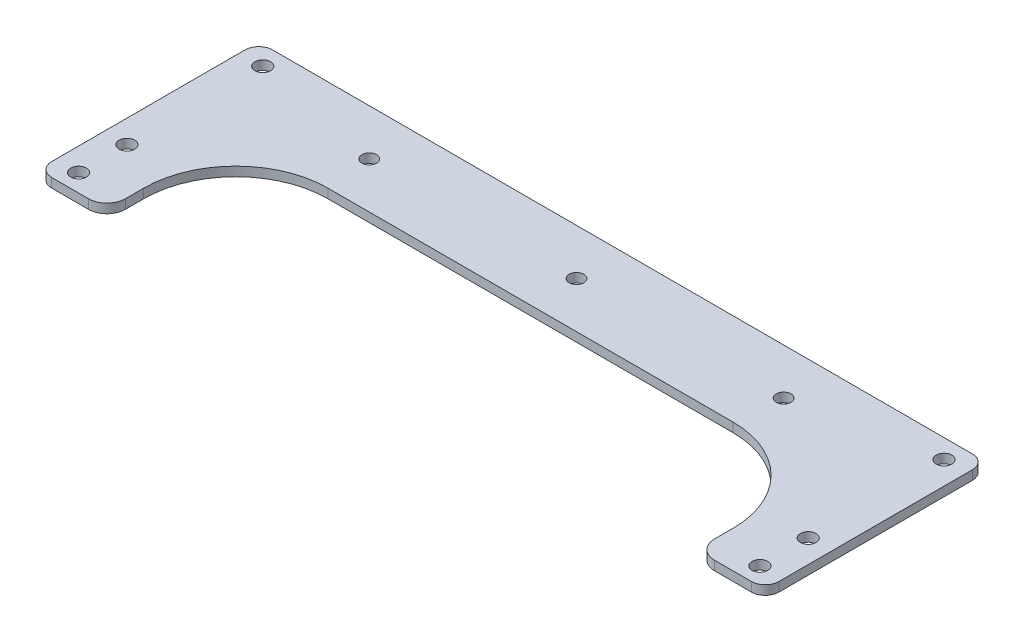
from build123d import *

# Parameters (mm, degrees)
SKETCH_1_W          = 158
SKETCH_1_H          = 48
EXTRUDE_1_DEPTH     = 2
SKETCH_2_W          = 128
SKETCH_2_H          = 28
CUT_EXTRUDE_1_DEPTH = 2
SKETCH_4_R          = 1.7
CUT_EXTRUDE_2_DEPTH = 2
SKETCH_5_R          = 1.6
CUT_EXTRUDE_3_DEPTH = 2
FILLET_4_R          = 3
FILLET_5_R          = 4
FILLET_6_R          = 20


with BuildPart() as part:
    # 草图1 → 凸台-拉伸1 (new body)
    with BuildSketch(Plane(origin=(0, 0, 0), x_dir=(1, 0, 0), z_dir=(0, 1, 0))):
        Rectangle(SKETCH_1_W, SKETCH_1_H)
    extrude(amount=EXTRUDE_1_DEPTH)

    # 草图2 → 切除-拉伸1 (cut)
    with BuildSketch(Plane(origin=(0, 2, 0), x_dir=(1, 0, 0), z_dir=(0, 1, 0))):
        with Locations((0, -10)):
            Rectangle(SKETCH_2_W, SKETCH_2_H)
    extrude(amount=-CUT_EXTRUDE_1_DEPTH, mode=Mode.SUBTRACT)

    # 草图4 → 切除-拉伸2 (cut)
    with BuildSketch(Plane(origin=(0, 2, 0), x_dir=(1, 0, 0), z_dir=(0, 1, 0))):
        with Locations(Location((-74, 19.85, 0), (0, 0, 270))):
            Circle(SKETCH_4_R)
        with Locations(Location((-74, -9.65, 0), (0, 0, 270))):
            Circle(SKETCH_4_R)
        with Locations(Location((-74, -20.15, 0), (0, 0, 270))):
            Circle(SKETCH_4_R)
        with Locations(Location((74, -20.15, 0), (0, 0, 90))):
            Circle(SKETCH_4_R)
        with Locations(Location((74, -9.65, 0), (0, 0, 90))):
            Circle(SKETCH_4_R)
        with Locations(Location((74, 19.85, 0), (0, 0, 90))):
            Circle(SKETCH_4_R)
    extrude(amount=-CUT_EXTRUDE_2_DEPTH, mode=Mode.SUBTRACT)

    # 草图5 → 切除-拉伸3 (cut)
    with BuildSketch(Plane(origin=(0, 2, 0), x_dir=(1, 0, 0), z_dir=(0, 1, 0))):
        with Locations(Location((0, 14, 0), (0, 0, 270))):
            Circle(SKETCH_5_R)
        with Locations(Location((-45, 14, 0), (0, 0, 270))):
            Circle(SKETCH_5_R)
        with Locations(Location((45, 14, 0), (0, 0, 270))):
            Circle(SKETCH_5_R)
    extrude(amount=-CUT_EXTRUDE_3_DEPTH, mode=Mode.SUBTRACT)

    # 圆角4
    fillet_4_edges = [part.edges().sort_by_distance(p)[0] for p in [
        (79, 1, 24),
        (-79, 1, 24),
        (-79, 1, -24),
        (79, 1, -24),
    ]]
    fillet(fillet_4_edges, radius=FILLET_4_R)

    # 圆角5
    fillet_5_edges = [part.edges().sort_by_distance(p)[0] for p in [
        (64, 1, 24),
        (-64, 1, 24),
    ]]
    fillet(fillet_5_edges, radius=FILLET_5_R)

    # 圆角6
    fillet_6_edges = [part.edges().sort_by_distance(p)[0] for p in [
        (64, 1, -4),
        (-64, 1, -4),
    ]]
    fillet(fillet_6_edges, radius=FILLET_6_R)


solid = part.part
